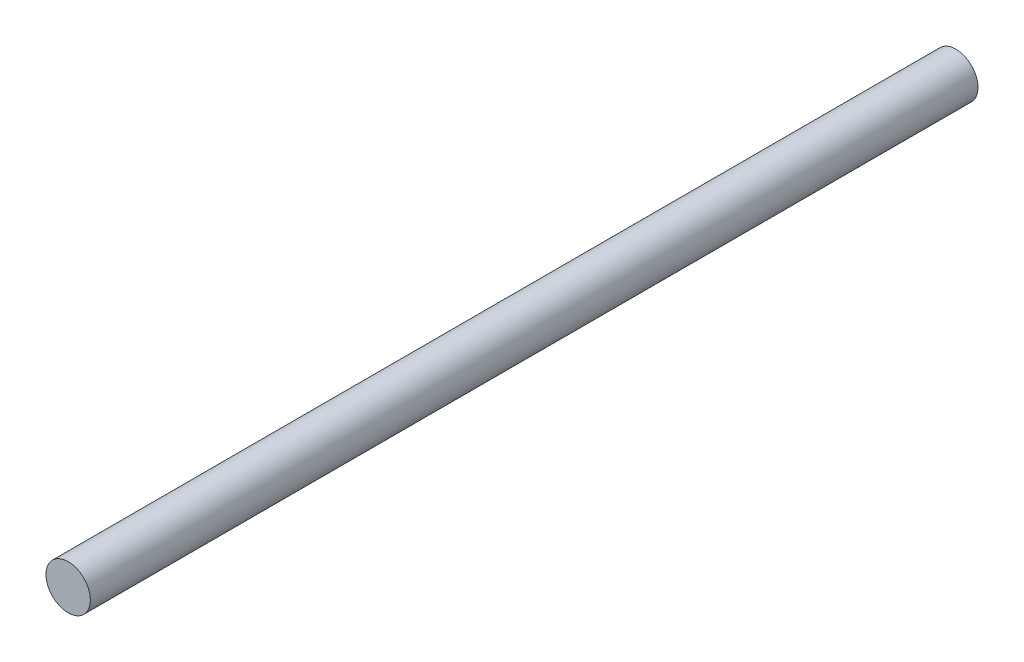
from build123d import *

# Parameters (mm, degrees)
IZIM1_R                     = 7.5
Y_KSEKLIK_EKSTR_ZYON1_DEPTH = 300


with BuildPart() as part:
    # Çizim1 → Yükseklik-Ekstrüzyon1 (new body)
    with BuildSketch(Plane.XY):
        Circle(IZIM1_R)
    extrude(amount=Y_KSEKLIK_EKSTR_ZYON1_DEPTH)


solid = part.part
